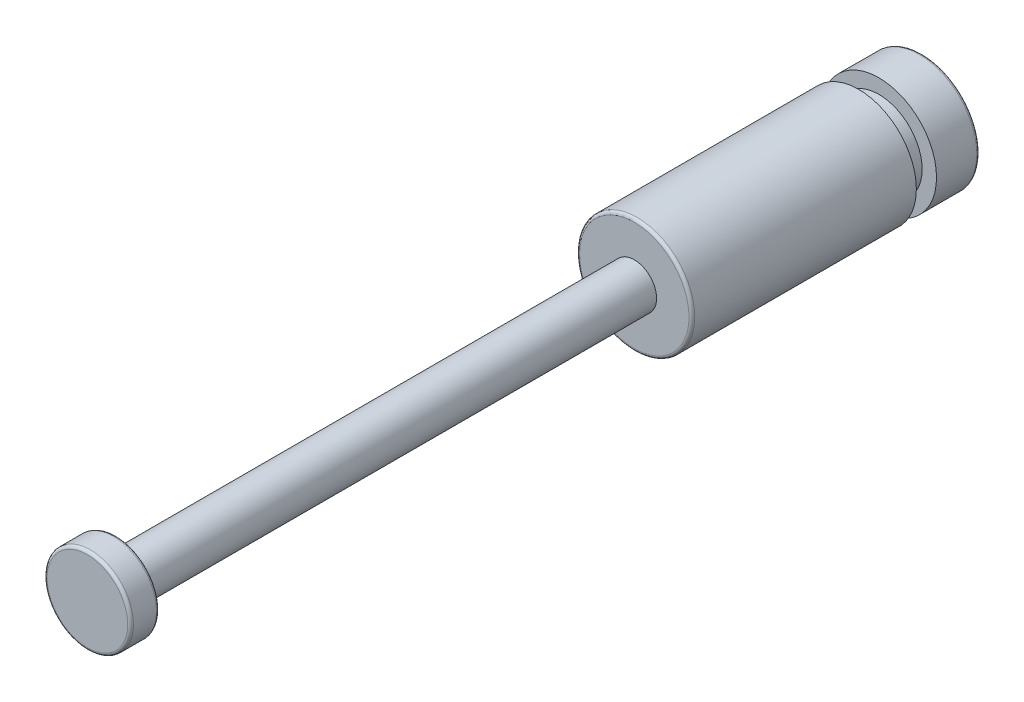
from build123d import *

# Parameters (mm, degrees)
SKETCH1_R           = 0.775
BOSS_EXTRUDE1_DEPTH = 18
SKETCH2_R           = 1.5
BOSS_EXTRUDE2_DEPTH = 1
SKETCH3_R           = 2
BOSS_EXTRUDE4_DEPTH = 10
SKETCH5_W           = 0.7
SKETCH5_H           = 0.5
FILLET1_R           = 0.1


with BuildPart() as part:
    # Sketch1 → Boss-Extrude1 (new body)
    with BuildSketch(Plane.XY):
        Circle(SKETCH1_R)
    extrude(amount=BOSS_EXTRUDE1_DEPTH)

    # Sketch2 → Boss-Extrude2 (add)
    with BuildSketch(Plane.XY.offset(18)):
        Circle(SKETCH2_R)
    extrude(amount=BOSS_EXTRUDE2_DEPTH)

    # Sketch3 → Boss-Extrude4 (add)
    with BuildSketch(Plane(origin=(0, 0, 0), x_dir=(-1, 0, 0), z_dir=(0, 0, -1))):
        Circle(SKETCH3_R)
    extrude(amount=BOSS_EXTRUDE4_DEPTH)

    # Sketch5 → Cut-Revolve1 (revolve, cut)
    with BuildSketch(Plane(origin=(0, 0, 0), x_dir=(0, 0, -1), z_dir=(1, 0, 0)), mode=Mode.PRIVATE) as cut_revolve1_sk:
        with Locations((8.15, 1.75)):
            Rectangle(SKETCH5_W, SKETCH5_H)
    revolve(cut_revolve1_sk.sketch.rotate(Axis((0, 0, 0), (0, 0, -1)), 90), axis=Axis((0, 0, 0), (0, 0, -1)), mode=Mode.SUBTRACT)

    # Fillet1
    fillet1_edges = [part.edges().sort_by_distance(p)[0] for p in [
        (-1.5, 0, 18),
        (-1.5, 0, 19),
        (2, 0, 0),
        (2, 0, -10),
    ]]
    fillet(fillet1_edges, radius=FILLET1_R)


solid = part.part
